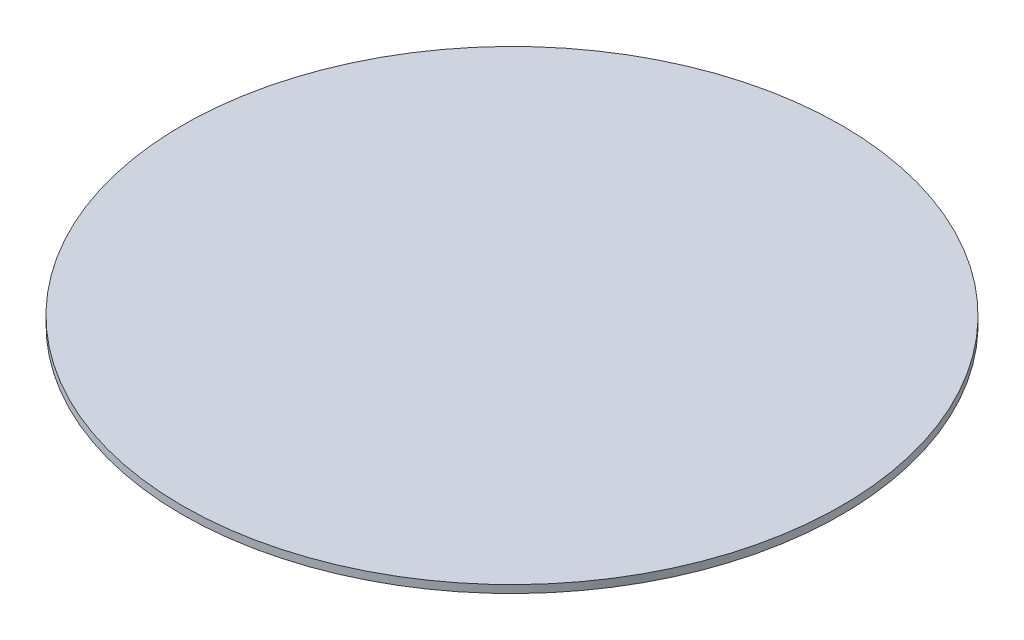
from build123d import *

# Parameters (mm, degrees)
SKETCH1_R           = 34
BOSS_EXTRUDE1_DEPTH = 0.8


with BuildPart() as part:
    # Sketch1 → Boss-Extrude1 (new body)
    with BuildSketch(Plane(origin=(0, 0, 0), x_dir=(1, 0, 0), z_dir=(0, 1, 0))):
        with Locations(Location((0, 0, 0), (0, 0, 270))):
            Circle(SKETCH1_R)
    extrude(amount=BOSS_EXTRUDE1_DEPTH)


solid = part.part
